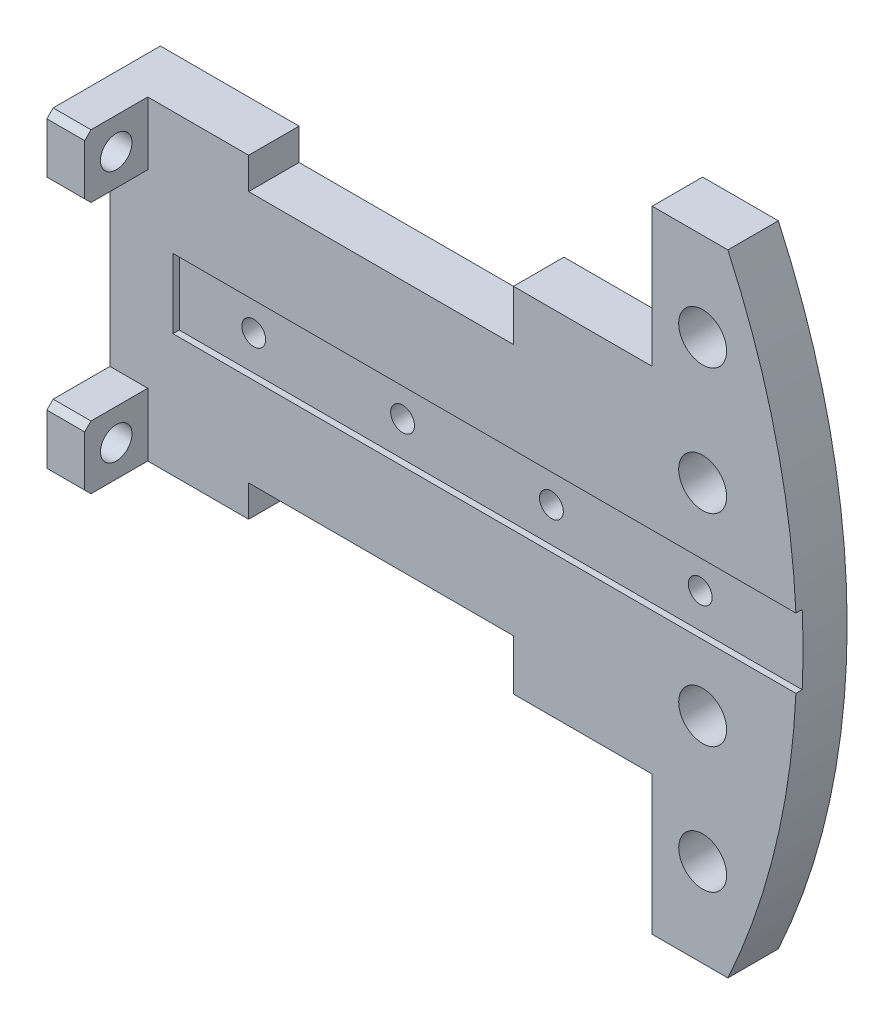
from build123d import *

# Parameters (mm, degrees)
BOSS_EXTRUDE1_DEPTH      = 5.08
SKETCH2_W                = 63.5
SKETCH2_H                = 7
CUT_EXTRUDE1_DEPTH       = 0.635
SKETCH3_W                = 6.35
SKETCH3_H                = 6.35
SKETCH3_R                = 1.5875
BOSS_EXTRUDE2_DEPTH      = 3.81
CHAMFER1_SIZE            = 0.635
CHAMFER1_OF_MIRROR1_SIZE = 0.635
SKETCH6_R                = 2.413
CUT_EXTRUDE2_DEPTH       = 103.813663911
SKETCH7_R                = 1.20015
CUT_EXTRUDE3_DEPTH       = 103.854835627


with BuildPart() as part:
    # Sketch1 → Boss-Extrude1 (new body)
    with BuildSketch(Plane.XY):
        with BuildLine():
            Line((-35.352091015, 31.75), (-42.972091015, 31.75))
            Line((-42.972091015, 31.75), (-42.972091015, 17.78))
            Line((-42.972091015, 17.78), (-56.942091015, 17.78))
            Line((-56.942091015, 17.78), (-56.942091015, 12.7))
            Line((-56.942091015, 12.7), (-83.612091015, 12.7))
            Line((-83.612091015, 12.7), (-83.612091015, 15.875))
            Line((-83.612091015, 15.875), (-97.582091015, 15.875))
            Line((-97.582091015, 15.875), (-97.582091015, -15.875))
            Line((-97.582091015, -15.875), (-83.612091015, -15.875))
            Line((-83.612091015, -15.875), (-83.612091015, -12.7))
            Line((-83.612091015, -12.7), (-56.942091015, -12.7))
            Line((-56.942091015, -12.7), (-56.942091015, -17.78))
            Line((-56.942091015, -17.78), (-42.972091015, -17.78))
            Line((-42.972091015, -17.78), (-42.972091015, -31.75))
            Line((-42.972091015, -31.75), (-35.352091015, -31.75))
            ThreePointArc((-35.352091015, -31.75), (-28.422412943, 0), (-35.352091015, 31.75))
        make_face()
    extrude(amount=BOSS_EXTRUDE1_DEPTH)

    # Sketch2 → Cut-Extrude1 (cut)
    with BuildSketch(Plane.XY.offset(5.08)):
        with Locations((-59.482091015, 0)):
            Rectangle(SKETCH2_W, SKETCH2_H)
    extrude(amount=-CUT_EXTRUDE1_DEPTH, mode=Mode.SUBTRACT)

    # Sketch3 → Boss-Extrude2 (add)
    with BuildSketch(Plane.ZY.offset(97.582091015)):
        with Locations((8.255, 12.7)):
            Rectangle(SKETCH3_W, SKETCH3_H)
        with Locations((8.255, 12.7)):
            Circle(SKETCH3_R, mode=Mode.SUBTRACT)
    boss_extrude2 = extrude(amount=-BOSS_EXTRUDE2_DEPTH)

    # Chamfer1
    chamfer1_edges = [part.edges().sort_by_distance(p)[0] for p in [
        (-95.677091015, 9.525, 11.43),
        (-95.677091015, 15.875, 11.43),
    ]]
    chamfer(chamfer1_edges, length=CHAMFER1_SIZE)

    # Mirror1: Boss-Extrude2 across plane
    add(boss_extrude2.mirror(Plane.ZX))

    # Chamfer1 of Mirror1
    chamfer1_of_mirror1_edges = [part.edges().sort_by_distance(p)[0] for p in [
        (-95.677091015, -9.525, 11.43),
        (-95.677091015, -15.875, 11.43),
    ]]
    chamfer(chamfer1_of_mirror1_edges, length=CHAMFER1_OF_MIRROR1_SIZE)

    # Sketch6 → Cut-Extrude2 (cut, through all)
    with BuildSketch(Plane.XY.offset(5.08)):
        with Locations((-37.892091015, 22.86)):
            Circle(SKETCH6_R)
        with Locations((-37.892091015, 10.16)):
            Circle(SKETCH6_R)
        with Locations(Location((-37.892091015, -10.16, 0), (0, 0, 180))):
            Circle(SKETCH6_R)
        with Locations(Location((-37.892091015, -22.86, 0), (0, 0, 180))):
            Circle(SKETCH6_R)
    extrude(amount=-CUT_EXTRUDE2_DEPTH, mode=Mode.SUBTRACT)

    # Sketch7 → Cut-Extrude3 (cut, through all)
    with BuildSketch(Plane.XY.offset(4.445)):
        with Locations((-83.731471015, 0)):
            Circle(SKETCH7_R)
        with Locations((-68.745471015, 0)):
            Circle(SKETCH7_R)
        with Locations((-53.759471015, 0)):
            Circle(SKETCH7_R)
        with Locations((-38.773471015, 0)):
            Circle(SKETCH7_R)
    extrude(amount=-CUT_EXTRUDE3_DEPTH, mode=Mode.SUBTRACT)


solid = part.part
